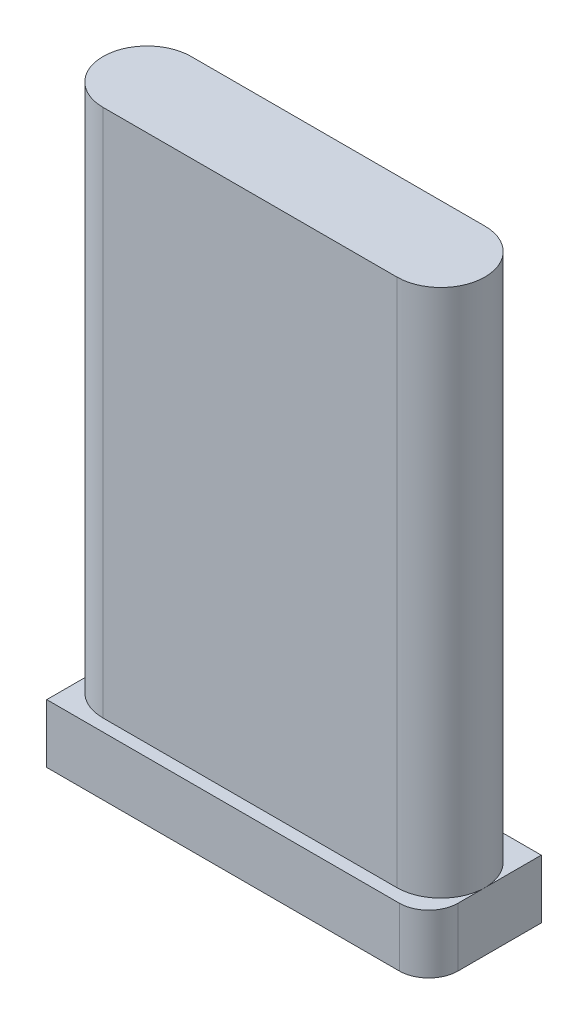
from build123d import *

# Parameters (mm, degrees)
EXTRUDE_1_DEPTH     = 18
SKETCH_2_W          = 13
SKETCH_2_H          = 3.83198423
EXTRUDE_2_DEPTH     = 2
SKETCH_5_W          = 0.107212475
SKETCH_5_H          = 0.128654971
CUT_EXTRUDE_1_DEPTH = 0.5
FILLET_3_R          = 1
FILLET_4_R          = 1


with BuildPart() as part:
    # 草图1 → 凸台-拉伸1 (new body)
    with BuildSketch(Plane(origin=(0, 0, 0), x_dir=(1, 0, 0), z_dir=(0, 1, 0))):
        with BuildLine():
            Line((-5, 1.5), (5, 1.5))
            ThreePointArc((5, 1.5), (6.5, 0), (5, -1.5))
            Line((5, -1.5), (-5, -1.5))
            ThreePointArc((-5, -1.5), (-6.5, 0), (-5, 1.5))
        make_face()
    extrude(amount=EXTRUDE_1_DEPTH)

    # 草图2 → 凸台-拉伸2 (add)
    with BuildSketch(Plane.XZ):
        Rectangle(SKETCH_2_W, SKETCH_2_H)
    extrude(amount=EXTRUDE_2_DEPTH)

    # 草图5 → 切除-拉伸1 (cut)
    # profile 1 of 12: a face of its own
    with BuildSketch(Plane.XZ.offset(2)):
        with BuildLine():
            Line((-1.02805632, -1.163211224), (-1.12119039, -1.163211224))
            Line((-1.12119039, -1.163211224), (-1.12119039, -1.075491926))
            add(Edge.make_bspline(
                [(-1.12119039, -1.075491926), (-1.125826492, -1.083779294), (-1.134718723, -1.099674798), (-1.150757558, -1.120561989), (-1.167526976, -1.138180102), (-1.185936765, -1.151956709), (-1.20581427, -1.162249349), (-1.227241919, -1.169685065), (-1.250464438, -1.174041531), (-1.266504279, -1.174613154), (-1.274753309, -1.17490713)],
                knots=[0, 0, 0, 0, 1.174709756, 2.253140365, 3.252247874, 4.178642246, 5.086553947, 6.014112808, 6.978690469, 8, 8, 8, 8], degree=3))
            add(Edge.make_bspline(
                [(-1.274753309, -1.17490713), (-1.282348599, -1.174653903), (-1.297423973, -1.17415129), (-1.319596673, -1.170239132), (-1.340851493, -1.163344952), (-1.361265544, -1.15406953), (-1.380707605, -1.141981113), (-1.399189397, -1.127265822), (-1.417064027, -1.110157631), (-1.433649445, -1.090110249), (-1.449135963, -1.067675428), (-1.462405679, -1.042287873), (-1.473265502, -1.014153308), (-1.482669924, -0.983579068), (-1.489733723, -0.950305537), (-1.494581026, -0.914464968), (-1.49766591, -0.875993165), (-1.498067465, -0.849449448), (-1.498275077, -0.835725844)],
                knots=[0, 0, 0, 0, 0.803415974, 1.594645798, 2.372561691, 3.162204217, 3.961432765, 4.788224023, 5.658044298, 6.574515724, 7.53646856, 8.53765953, 9.597323997, 10.723414068, 11.919076493, 13.191717926, 14.548064934, 16, 16, 16, 16], degree=3))
            add(Edge.make_bspline(
                [(-1.498275077, -0.835725844), (-1.498065146, -0.822002455), (-1.497658003, -0.795387177), (-1.494586362, -0.756769588), (-1.489703039, -0.720648869), (-1.482707016, -0.687072492), (-1.473227162, -0.656159154), (-1.462359071, -0.62761024), (-1.449144241, -0.601628437), (-1.433651006, -0.578547086), (-1.417073745, -0.55785133), (-1.399191229, -0.540104541), (-1.380780032, -0.524725378), (-1.36133026, -0.512172965), (-1.340856958, -0.502703322), (-1.319611564, -0.49559536), (-1.297445186, -0.491396255), (-1.282351386, -0.490930873), (-1.274753309, -0.490696604)],
                knots=[0, 0, 0, 0, 1.438076013, 2.789019155, 4.057007111, 5.256053152, 6.378633748, 7.442270566, 8.454050262, 9.425651909, 10.350896601, 11.228315056, 12.061456595, 12.86111499, 13.646397793, 14.419225205, 15.204252816, 16, 16, 16, 16], degree=3))
            add(Edge.make_bspline(
                [(-1.274753309, -0.490696604), (-1.26650375, -0.491056339), (-1.250439299, -0.491756856), (-1.22708129, -0.496442107), (-1.205701692, -0.505120977), (-1.185852301, -0.516720608), (-1.167709871, -0.531816394), (-1.150713211, -0.550010654), (-1.134846686, -0.571521728), (-1.125850888, -0.587619768), (-1.12119039, -0.595959762)],
                knots=[0, 0, 0, 0, 1.005885868, 1.95877182, 2.887154711, 3.806480809, 4.750914281, 5.753444165, 6.83611536, 8, 8, 8, 8], degree=3))
            Line((-1.12119039, -0.595959762), (-1.12119039, -0.163211224))
            Line((-1.12119039, -0.163211224), (-1.02805632, -0.163211224))
            Line((-1.02805632, -0.163211224), (-1.02805632, -1.163211224))
        make_face()
        with BuildLine():
            add(Edge.make_bspline(
                [(-1.12119039, -0.835725844), (-1.121335947, -0.826699624), (-1.121619185, -0.809135551), (-1.123211196, -0.783512226), (-1.1265738, -0.759384229), (-1.130864876, -0.736677245), (-1.136120674, -0.715302357), (-1.143167217, -0.69560597), (-1.151144059, -0.677220183), (-1.160426801, -0.660445279), (-1.170487508, -0.645358271), (-1.181168051, -0.632245886), (-1.192248891, -0.62102482), (-1.203931743, -0.611859738), (-1.216264529, -0.604774592), (-1.229121058, -0.599797428), (-1.242473496, -0.596616996), (-1.251560754, -0.59617955), (-1.256126495, -0.595959762)],
                knots=[0, 0, 0, 0, 1.432479259, 2.787453692, 4.070687906, 5.295251639, 6.453948626, 7.559073814, 8.610643949, 9.631047629, 10.597004077, 11.484497415, 12.310798766, 13.09454635, 13.833470659, 14.55895071, 15.275968737, 16, 16, 16, 16], degree=3))
            add(Edge.make_bspline(
                [(-1.256126495, -0.595959762), (-1.261772144, -0.596172072), (-1.27278681, -0.59658629), (-1.288746669, -0.599692453), (-1.303621794, -0.604685638), (-1.317487901, -0.611657993), (-1.330107527, -0.620904306), (-1.341664581, -0.63206941), (-1.352174562, -0.645227136), (-1.361353904, -0.660452495), (-1.369562169, -0.677266756), (-1.376422931, -0.695679559), (-1.382516293, -0.715399126), (-1.387539608, -0.736659879), (-1.391008826, -0.759423632), (-1.393993676, -0.783531169), (-1.395348331, -0.809142383), (-1.395664881, -0.826700389), (-1.3958276, -0.835725844)],
                knots=[0, 0, 0, 0, 0.872697501, 1.702633898, 2.504143522, 3.293111638, 4.092674618, 4.913928249, 5.771858229, 6.689130751, 7.657895829, 8.661550593, 9.724622335, 10.848574145, 12.036219453, 13.284062286, 14.603909012, 16, 16, 16, 16], degree=3))
            add(Edge.make_bspline(
                [(-1.3958276, -0.835725844), (-1.395667326, -0.844751477), (-1.39535681, -0.862237772), (-1.393976313, -0.887774606), (-1.391046355, -0.911672553), (-1.387539965, -0.934146028), (-1.382511208, -0.954971043), (-1.376472879, -0.974208886), (-1.369541554, -0.992019858), (-1.361436386, -1.008184376), (-1.352025127, -1.022604802), (-1.341742543, -1.035299968), (-1.330019037, -1.045801277), (-1.317420448, -1.054586873), (-1.303615731, -1.061382019), (-1.288704701, -1.066057431), (-1.27279915, -1.069304615), (-1.261774983, -1.069529002), (-1.256126495, -1.069643973)],
                knots=[0, 0, 0, 0, 1.417119592, 2.74553286, 4.012171311, 5.195335048, 6.314160584, 7.371600832, 8.35867376, 9.311580589, 10.204356249, 11.057626038, 11.868044535, 12.666567361, 13.462350821, 14.272372967, 15.114810271, 16, 16, 16, 16], degree=3))
            add(Edge.make_bspline(
                [(-1.256126495, -1.069643973), (-1.251557707, -1.069520207), (-1.242459279, -1.069273736), (-1.229167464, -1.065957062), (-1.216268284, -1.061297596), (-1.203996166, -1.054392961), (-1.192329784, -1.045687056), (-1.181081857, -1.035122697), (-1.170634382, -1.022463734), (-1.160341178, -1.008198469), (-1.151167114, -0.992065948), (-1.143113356, -0.97428896), (-1.136127223, -0.955068957), (-1.130864405, -0.934128524), (-1.126529552, -0.911714414), (-1.123231399, -0.887792905), (-1.12160961, -0.862244855), (-1.121333083, -0.844752316), (-1.12119039, -0.835725844)],
                knots=[0, 0, 0, 0, 0.73435204, 1.462411633, 2.194918564, 2.939518723, 3.721267318, 4.535989702, 5.419252214, 6.361808964, 7.367504887, 8.403426123, 9.503648099, 10.657658594, 11.878232492, 13.181227598, 14.545461582, 16, 16, 16, 16], degree=3))
        make_face(mode=Mode.SUBTRACT)
    # profile 2 of 12: a face of its own
    with BuildSketch(Plane.XZ.offset(2)):
        with BuildLine():
            add(Edge.make_bspline(
                [(-0.477525672, -0.835725844), (-0.477733284, -0.849449448), (-0.478134839, -0.875993165), (-0.481219723, -0.914464968), (-0.486067026, -0.950305537), (-0.493130825, -0.983579068), (-0.502535247, -1.014153308), (-0.51339507, -1.042287873), (-0.526664786, -1.067675428), (-0.542151304, -1.090110249), (-0.558736722, -1.110157631), (-0.576611352, -1.127265822), (-0.595093144, -1.141981113), (-0.614535205, -1.15406953), (-0.634949256, -1.163344952), (-0.656204076, -1.170239132), (-0.678376776, -1.17415129), (-0.69345215, -1.174653903), (-0.70104744, -1.17490713)],
                knots=[0, 0, 0, 0, 1.451935066, 2.808282074, 4.080923507, 5.276585932, 6.402676003, 7.46234047, 8.46353144, 9.425484276, 10.341955702, 11.211775977, 12.038567235, 12.837795783, 13.627438309, 14.405354202, 15.196584026, 16, 16, 16, 16], degree=3))
            add(Edge.make_bspline(
                [(-0.70104744, -1.17490713), (-0.709295425, -1.17460724), (-0.725404211, -1.174021537), (-0.748709926, -1.16971854), (-0.77020262, -1.162246753), (-0.790080697, -1.151957412), (-0.808490329, -1.138179896), (-0.825259792, -1.120562051), (-0.841298613, -1.099674781), (-0.850190846, -1.083779288), (-0.85482695, -1.075491926)],
                knots=[0, 0, 0, 0, 1.020188805, 1.992486735, 2.919027747, 3.825943157, 4.751320956, 5.749332102, 6.826579303, 8, 8, 8, 8], degree=3))
            Line((-0.85482695, -1.075491926), (-0.85482695, -1.163211224))
            Line((-0.85482695, -1.163211224), (-0.94796102, -1.163211224))
            Line((-0.94796102, -1.163211224), (-0.94796102, -0.163211224))
            Line((-0.94796102, -0.163211224), (-0.85482695, -0.163211224))
            Line((-0.85482695, -0.163211224), (-0.85482695, -0.595959762))
            add(Edge.make_bspline(
                [(-0.85482695, -0.595959762), (-0.85016645, -0.587619775), (-0.84117065, -0.571521747), (-0.825304141, -0.550010587), (-0.808307427, -0.531816619), (-0.790165184, -0.516719827), (-0.770315121, -0.50512382), (-0.748872264, -0.496404491), (-0.725428459, -0.491778867), (-0.709295752, -0.491062743), (-0.70104744, -0.490696604)],
                knots=[0, 0, 0, 0, 1.162631916, 2.2441378, 3.245588632, 4.189005582, 5.107342182, 6.034725827, 6.995196796, 8, 8, 8, 8], degree=3))
            add(Edge.make_bspline(
                [(-0.70104744, -0.490696604), (-0.693449363, -0.490930873), (-0.678355563, -0.491396255), (-0.656189185, -0.49559536), (-0.634943791, -0.502703322), (-0.614470489, -0.512172965), (-0.595020717, -0.524725378), (-0.57660952, -0.540104541), (-0.558727004, -0.55785133), (-0.542149743, -0.578547086), (-0.526656508, -0.601628437), (-0.513441678, -0.62761024), (-0.502573587, -0.656159154), (-0.493093733, -0.687072492), (-0.48609771, -0.720648869), (-0.481214387, -0.756769588), (-0.478142746, -0.795387177), (-0.477735603, -0.822002455), (-0.477525672, -0.835725844)],
                knots=[0, 0, 0, 0, 0.795747184, 1.580774795, 2.353602207, 3.13888501, 3.938543405, 4.771684944, 5.649103399, 6.574348091, 7.545949738, 8.557729434, 9.621366252, 10.743946848, 11.942992889, 13.210980845, 14.561923987, 16, 16, 16, 16], degree=3))
        make_face()
        with BuildLine():
            add(Edge.make_bspline(
                [(-0.579973149, -0.835725844), (-0.580135915, -0.826700407), (-0.580452559, -0.809142437), (-0.581806559, -0.783530972), (-0.584793701, -0.759424316), (-0.588254989, -0.736657512), (-0.593305594, -0.715407256), (-0.599312852, -0.69562671), (-0.606509285, -0.677314961), (-0.614650262, -0.660449559), (-0.623835317, -0.645216842), (-0.634358343, -0.632149845), (-0.645696627, -0.620833633), (-0.658322942, -0.611668456), (-0.672176222, -0.604682806), (-0.687054841, -0.599693243), (-0.703013734, -0.596586078), (-0.714028536, -0.596172), (-0.719674254, -0.595959762)],
                knots=[0, 0, 0, 0, 1.396438336, 2.716613439, 3.964766736, 5.152707529, 6.276938979, 7.340275213, 8.34820958, 9.317215687, 10.234716427, 11.09285986, 11.906307124, 12.706069036, 13.495233447, 14.296942486, 15.127085372, 16, 16, 16, 16], degree=3))
            add(Edge.make_bspline(
                [(-0.719674254, -0.595959762), (-0.724239943, -0.596179602), (-0.733327097, -0.596617154), (-0.74668031, -0.599796802), (-0.759533849, -0.604776991), (-0.771878271, -0.611850366), (-0.783554435, -0.621094929), (-0.794857981, -0.632164428), (-0.805517431, -0.64537082), (-0.815594192, -0.660441582), (-0.824872247, -0.677221229), (-0.832850419, -0.69560567), (-0.839896581, -0.715302443), (-0.845152488, -0.73667722), (-0.849443533, -0.759384236), (-0.852806146, -0.783512224), (-0.854398154, -0.809135551), (-0.854681393, -0.826699624), (-0.85482695, -0.835725844)],
                knots=[0, 0, 0, 0, 0.723663085, 1.4403165, 2.165427637, 2.903976194, 3.687325234, 4.52134258, 5.408384618, 6.373849866, 7.393734659, 8.444770059, 9.549333278, 10.707441056, 11.931382085, 13.213963759, 14.568249173, 16, 16, 16, 16], degree=3))
            add(Edge.make_bspline(
                [(-0.85482695, -0.835725844), (-0.854684257, -0.844752316), (-0.85440773, -0.862244854), (-0.852785942, -0.887792908), (-0.849487781, -0.911714406), (-0.845152958, -0.934128549), (-0.839890037, -0.955068871), (-0.832904262, -0.974289259), (-0.824849268, -0.992064916), (-0.815679537, -1.008202104), (-0.805371536, -1.022451434), (-0.794940417, -1.035205066), (-0.783477377, -1.045616712), (-0.771813522, -1.054402572), (-0.759530162, -1.06129512), (-0.74663389, -1.065957713), (-0.733341317, -1.069273572), (-0.724242991, -1.069520152), (-0.719674254, -1.069643973)],
                knots=[0, 0, 0, 0, 1.453765221, 2.817274013, 4.119576478, 5.33950155, 6.492898601, 7.592535726, 8.627906292, 9.633067612, 10.575123322, 11.457916314, 12.280710816, 13.062043853, 13.806248201, 14.538365749, 15.266038324, 16, 16, 16, 16], degree=3))
            add(Edge.make_bspline(
                [(-0.719674254, -1.069643973), (-0.714025698, -1.069529077), (-0.703001398, -1.069304836), (-0.687096792, -1.066056612), (-0.672182365, -1.061384942), (-0.658390039, -1.054576142), (-0.645788956, -1.045872144), (-0.634276639, -1.035218761), (-0.623985702, -1.02261475), (-0.614567885, -1.008187471), (-0.60652864, -0.991970332), (-0.599263151, -0.97426359), (-0.593310824, -0.954962551), (-0.588254586, -0.934148501), (-0.584756223, -0.911671823), (-0.581823908, -0.887774816), (-0.580444084, -0.862237714), (-0.580133473, -0.844751457), (-0.579973149, -0.835725844)],
                knots=[0, 0, 0, 0, 0.88541906, 1.728074619, 2.538306622, 3.33429625, 4.133025954, 4.935287746, 5.788778596, 6.681785553, 7.634939257, 8.626489366, 9.684203571, 10.803318967, 11.986789233, 13.253755839, 14.582513267, 16, 16, 16, 16], degree=3))
        make_face(mode=Mode.SUBTRACT)
    # profile 3 of 12: a face of its own
    with BuildSketch(Plane.XZ.offset(2)):
        with Locations((-0.320648913, -1.098883739)):
            Rectangle(SKETCH_5_W, SKETCH_5_H)
    # profile 4 of 12: a face of its own
    with BuildSketch(Plane.XZ.offset(2)):
        with BuildLine():
            add(Edge.make_bspline(
                [(1.127066054, -0.829877891), (1.126826608, -0.84446482), (1.126363847, -0.872655955), (1.123723789, -0.913394935), (1.11863485, -0.950972816), (1.11214871, -0.985572575), (1.103295597, -1.017027882), (1.092485898, -1.045412249), (1.079737239, -1.070750024), (1.064905316, -1.093023536), (1.048411759, -1.112386131), (1.030432258, -1.128976775), (1.01130693, -1.143286816), (0.990485427, -1.154765675), (0.968442461, -1.163965567), (0.944890006, -1.170154503), (0.920074947, -1.174228207), (0.902983717, -1.174677193), (0.89423088, -1.17490713)],
                knots=[0, 0, 0, 0, 1.486786668, 2.873408288, 4.157555986, 5.349518925, 6.458271403, 7.483132839, 8.440729295, 9.342746622, 10.203893069, 11.026551008, 11.831546077, 12.631988447, 13.443647967, 14.25936631, 15.108578851, 16, 16, 16, 16], degree=3))
            add(Edge.make_bspline(
                [(0.89423088, -1.17490713), (0.886274156, -1.17464974), (0.870563591, -1.174141522), (0.847544002, -1.170341681), (0.825459441, -1.164367089), (0.804532796, -1.155503976), (0.784453447, -1.144484057), (0.765565991, -1.130692858), (0.747754025, -1.114475372), (0.730705142, -1.096080247), (0.71521841, -1.074762925), (0.701994008, -1.050266575), (0.691093608, -1.022705165), (0.681715486, -0.992327403), (0.674667561, -0.958827567), (0.669848877, -0.922404665), (0.666760219, -0.882995419), (0.666365602, -0.855730551), (0.666160704, -0.841573797)],
                knots=[0, 0, 0, 0, 0.839199475, 1.657000945, 2.45541367, 3.247660954, 4.048975689, 4.867238262, 5.708647614, 6.58746802, 7.509343168, 8.480869226, 9.516352645, 10.632010286, 11.831777626, 13.123499464, 14.506432833, 16, 16, 16, 16], degree=3))
            Line((0.666160704, -0.841573797), (0.666160704, -0.777246312))
            Line((0.666160704, -0.777246312), (0.773156589, -0.777246312))
            Line((0.773156589, -0.777246312), (0.773156589, -0.859117657))
            add(Edge.make_bspline(
                [(0.773156589, -0.859117657), (0.77331619, -0.867565741), (0.773623376, -0.883825851), (0.774984958, -0.907348173), (0.777886233, -0.92887254), (0.781419574, -0.948614217), (0.786377261, -0.966377213), (0.792473384, -0.982214275), (0.799266076, -0.996355481), (0.810119286, -1.011743811), (0.825074053, -1.027527333), (0.845112608, -1.041633844), (0.866905248, -1.050446286), (0.882097304, -1.051549363), (0.889682472, -1.052100113)],
                knots=[0, 0, 0, 0, 1.208963819, 2.326904589, 3.368559454, 4.314665505, 5.194383674, 6.002012704, 6.741140787, 7.431682472, 8.688336075, 9.831616499, 10.917358293, 12, 12, 12, 12], degree=3))
            add(Edge.make_bspline(
                [(0.889682472, -1.052100113), (0.894967555, -1.052036039), (0.90523552, -1.051911554), (0.920031648, -1.049199518), (0.933998416, -1.046095672), (0.946668087, -1.040606769), (0.958603358, -1.03417946), (0.969267677, -1.025922365), (0.979094825, -1.016399967), (0.987776009, -1.005263938), (0.99554343, -0.992120491), (1.002112453, -0.976740156), (1.007789237, -0.958979475), (1.012128608, -0.938860458), (1.015875498, -0.916466583), (1.018382366, -0.891654509), (1.019892695, -0.864479637), (1.020009552, -0.845546803), (1.020070169, -0.835725844)],
                knots=[0, 0, 0, 0, 0.879390031, 1.708496612, 2.50252622, 3.258036476, 4.00156295, 4.757456617, 5.497956843, 6.278089744, 7.103782007, 8.03626356, 9.06019656, 10.207753371, 11.464262521, 12.843979269, 14.362889033, 16, 16, 16, 16], degree=3))
            Line((1.020070169, -0.835725844), (1.020070169, -0.163211224))
            Line((1.020070169, -0.163211224), (1.127066054, -0.163211224))
            Line((1.127066054, -0.163211224), (1.127066054, -0.829877891))
        make_face()
    # profile 5 of 12: a face of its own
    with BuildSketch(Plane.XZ.offset(2)):
        with BuildLine():
            Line((1.677596702, -1.163211224), (1.565835818, -1.163211224))
            add(Edge.make_bspline(
                [(1.565835818, -1.163211224), (1.562864602, -1.158701035), (1.556371228, -1.148844351), (1.551031576, -1.129936615), (1.547628996, -1.107105221), (1.54735642, -1.090383468), (1.547209004, -1.081339879)],
                knots=[0, 0, 0, 0, 0.755692807, 1.651510663, 2.729871745, 4, 4, 4, 4], degree=3))
            add(Edge.make_bspline(
                [(1.547209004, -1.081339879), (1.541689724, -1.088786713), (1.530813677, -1.103461111), (1.511584559, -1.122463837), (1.490794361, -1.138802583), (1.468294906, -1.151939512), (1.444654913, -1.162038092), (1.420443093, -1.169562533), (1.395540579, -1.173987663), (1.37871838, -1.174599356), (1.370254271, -1.17490713)],
                knots=[0, 0, 0, 0, 1.066987184, 2.1025574, 3.104587707, 4.107861057, 5.095589085, 6.06159213, 7.024687844, 8, 8, 8, 8], degree=3))
            add(Edge.make_bspline(
                [(1.370254271, -1.17490713), (1.364178032, -1.174834982), (1.352192548, -1.174692669), (1.3346531, -1.171986302), (1.317648433, -1.168840281), (1.301583007, -1.163387014), (1.285999619, -1.157026066), (1.271446461, -1.148656151), (1.257292679, -1.139332956), (1.244234313, -1.128348487), (1.232238955, -1.116006543), (1.221795729, -1.102249317), (1.212887114, -1.087300429), (1.205676483, -1.070999881), (1.200064891, -1.053505842), (1.196215577, -1.034619944), (1.193817203, -1.014547187), (1.193474733, -1.000702823), (1.193299539, -0.993620581)],
                knots=[0, 0, 0, 0, 1.019473972, 2.010929629, 2.976679566, 3.920239561, 4.855106573, 5.799913014, 6.735094691, 7.699472715, 8.660182727, 9.620816173, 10.594303763, 11.577041028, 12.608850109, 13.674534758, 14.810381812, 16, 16, 16, 16], degree=3))
            add(Edge.make_bspline(
                [(1.193299539, -0.993620581), (1.193398344, -0.986466903), (1.193590459, -0.972557467), (1.195837398, -0.952206745), (1.199446543, -0.932917021), (1.204666861, -0.914745067), (1.211144009, -0.897653597), (1.219264761, -0.8817213), (1.228726362, -0.866819263), (1.239679893, -0.853019899), (1.252117228, -0.840329745), (1.266272575, -0.828871173), (1.282053725, -0.818452337), (1.299248335, -0.808834973), (1.318342526, -0.800998176), (1.338752355, -0.793742576), (1.360843605, -0.787712119), (1.376225745, -0.78465991), (1.384116086, -0.783094265)],
                knots=[0, 0, 0, 0, 1.090965144, 2.121245881, 3.119285887, 4.081552798, 5.002062747, 5.9035279, 6.804925756, 7.690846656, 8.586573589, 9.510372729, 10.463518421, 11.469187795, 12.510537376, 13.607878435, 14.772949993, 16, 16, 16, 16], degree=3))
            add(Edge.make_bspline(
                [(1.384116086, -0.783094265), (1.394673476, -0.781079466), (1.415140119, -0.777173559), (1.444676917, -0.770188679), (1.472250309, -0.762655497), (1.497271271, -0.754580067), (1.518735689, -0.745692544), (1.534671903, -0.73479071), (1.545336284, -0.721782711), (1.546601123, -0.711846305), (1.547209004, -0.707070873)],
                knots=[0, 0, 0, 0, 1.358372605, 2.633352517, 3.835515171, 4.969630947, 5.958279621, 6.756029877, 7.402148543, 8, 8, 8, 8], degree=3))
            add(Edge.make_bspline(
                [(1.547209004, -0.707070873), (1.546948112, -0.701204532), (1.546420695, -0.689345167), (1.542386572, -0.671566195), (1.535386426, -0.654048582), (1.528222062, -0.63940039), (1.520359694, -0.628381616), (1.512622169, -0.621246149), (1.503551414, -0.615022698), (1.492869164, -0.610057617), (1.480560245, -0.60654409), (1.466903608, -0.603609403), (1.451645342, -0.60227274), (1.441008572, -0.601967357), (1.43544812, -0.601807715)],
                knots=[0, 0, 0, 0, 1.201047136, 2.428030805, 3.710519291, 5.059727363, 5.757709653, 6.469035333, 7.20320303, 8.003627984, 8.869028397, 9.820250763, 10.860519476, 12, 12, 12, 12], degree=3))
            add(Edge.make_bspline(
                [(1.43544812, -0.601807715), (1.426765103, -0.602143149), (1.41047793, -0.602772338), (1.387663325, -0.607290661), (1.368623608, -0.615761785), (1.353315334, -0.627665134), (1.341430544, -0.642587532), (1.331782825, -0.659840555), (1.323797607, -0.679534438), (1.320591383, -0.693797588), (1.318922238, -0.70122292)],
                knots=[0, 0, 0, 0, 1.226234213, 2.300109206, 3.262914802, 4.141960168, 5.011433283, 5.938427283, 6.926754434, 8, 8, 8, 8], degree=3))
            Line((1.318922238, -0.70122292), (1.216474761, -0.70122292))
            add(Edge.make_bspline(
                [(1.216474761, -0.70122292), (1.217341963, -0.693618418), (1.219047405, -0.678663387), (1.224005613, -0.657073758), (1.229918235, -0.636476556), (1.237827375, -0.617283042), (1.246882484, -0.599042385), (1.257781211, -0.582242646), (1.269983227, -0.566406925), (1.283810402, -0.552003701), (1.298934181, -0.538957568), (1.315308453, -0.527766753), (1.332456182, -0.517757577), (1.351010016, -0.510070813), (1.370583246, -0.503962471), (1.391257048, -0.499676244), (1.412997238, -0.497013657), (1.427859564, -0.496703116), (1.43544812, -0.496544557)],
                knots=[0, 0, 0, 0, 1.103598428, 2.170338963, 3.192178795, 4.192386246, 5.161508673, 6.12675942, 7.077051162, 8.042358131, 9.002874465, 9.953680048, 10.90088289, 11.862585012, 12.844558058, 13.855988384, 14.905288963, 16, 16, 16, 16], degree=3))
            add(Edge.make_bspline(
                [(1.43544812, -0.496544557), (1.44375967, -0.496679617), (1.459856735, -0.496941188), (1.483118108, -0.499836923), (1.504784775, -0.504398453), (1.524968114, -0.510552886), (1.543548309, -0.518799483), (1.560345931, -0.529114787), (1.575626836, -0.541089873), (1.589369691, -0.554838515), (1.601424556, -0.570225705), (1.612046036, -0.587070831), (1.620488095, -0.605623153), (1.628033189, -0.625367305), (1.633578251, -0.646655261), (1.637430407, -0.669413983), (1.639826085, -0.693591373), (1.640168012, -0.710241909), (1.640343074, -0.71876678)],
                knots=[0, 0, 0, 0, 1.155966974, 2.238773138, 3.255437077, 4.234066209, 5.169406268, 6.075647623, 6.969950584, 7.864986743, 8.773397007, 9.684912576, 10.628630906, 11.604523476, 12.623071688, 13.683368923, 14.813913343, 16, 16, 16, 16], degree=3))
            Line((1.640343074, -0.71876678), (1.640343074, -1.040404206))
            add(Edge.make_bspline(
                [(1.640343074, -1.040404206), (1.640777927, -1.051634765), (1.641620128, -1.073385518), (1.648866037, -1.104976687), (1.660914993, -1.134931845), (1.671925537, -1.15359728), (1.677596702, -1.163211224)],
                knots=[0, 0, 0, 0, 1.034579128, 2.003718185, 2.971781755, 4, 4, 4, 4], degree=3))
        make_face()
        with BuildLine():
            Line((1.547209004, -0.946836955), (1.547209004, -0.829877891))
            add(Edge.make_bspline(
                [(1.547209004, -0.829877891), (1.538138004, -0.833624483), (1.520412295, -0.840945727), (1.497497452, -0.84931471), (1.477242331, -0.855576044), (1.457785846, -0.860114371), (1.434156594, -0.865625785), (1.416834689, -0.86899789), (1.407507899, -0.870813563)],
                knots=[0, 0, 0, 0, 1.210374826, 2.365202409, 3.007430543, 3.82377418, 4.828235109, 6, 6, 6, 6], degree=3))
            add(Edge.make_bspline(
                [(1.407507899, -0.870813563), (1.401939658, -0.87184959), (1.391258354, -0.873836953), (1.376029546, -0.877442838), (1.36238656, -0.881814894), (1.350152662, -0.886495805), (1.33944801, -0.891892317), (1.330321422, -0.897972554), (1.322617618, -0.904460566), (1.314459259, -0.913804166), (1.307066583, -0.92697735), (1.300364289, -0.94393767), (1.296459127, -0.96247307), (1.295988188, -0.975336965), (1.295747016, -0.981924674)],
                knots=[0, 0, 0, 0, 1.156381088, 2.218233285, 3.192579397, 4.079483205, 4.890363406, 5.634447372, 6.313966524, 6.940755641, 8.156763269, 9.374913329, 10.655670945, 12, 12, 12, 12], degree=3))
            add(Edge.make_bspline(
                [(1.295747016, -0.981924674), (1.295992994, -0.987577031), (1.296478434, -0.998731987), (1.300437871, -1.014893626), (1.307169523, -1.029895463), (1.316014603, -1.043834246), (1.328031105, -1.05544507), (1.342844651, -1.064017326), (1.360454149, -1.068664138), (1.372971583, -1.069305831), (1.379567678, -1.069643973)],
                knots=[0, 0, 0, 0, 0.991579906, 1.956888123, 2.898948725, 3.869237069, 4.837370503, 5.80267872, 6.842115669, 8, 8, 8, 8], degree=3))
            add(Edge.make_bspline(
                [(1.379567678, -1.069643973), (1.386752838, -1.06932987), (1.401552784, -1.068682884), (1.423919543, -1.062434598), (1.44717693, -1.053304584), (1.471064246, -1.040702898), (1.494296519, -1.023988199), (1.515031034, -1.002393851), (1.532992668, -0.97641967), (1.542350219, -0.956947581), (1.547209004, -0.946836955)],
                knots=[0, 0, 0, 0, 0.784364532, 1.615629125, 2.523387198, 3.516104134, 4.561781045, 5.639645558, 6.774417002, 8, 8, 8, 8], degree=3))
        make_face(mode=Mode.SUBTRACT)
    # profile 6 of 12: a face of its own
    with BuildSketch(Plane.XZ.offset(2)):
        with BuildLine():
            Line((2.246537572, -1.163211224), (2.153403502, -1.163211224))
            Line((2.153403502, -1.163211224), (2.153403502, -0.689527013))
            add(Edge.make_bspline(
                [(2.153403502, -0.689527013), (2.153274399, -0.683890692), (2.153027123, -0.673095222), (2.151288391, -0.657662539), (2.148547351, -0.643698947), (2.14462462, -0.631300788), (2.13891547, -0.620737076), (2.130454998, -0.612784252), (2.119252816, -0.608449166), (2.111131627, -0.607930161), (2.106836468, -0.607655668)],
                knots=[0, 0, 0, 0, 1.270035363, 2.432549112, 3.495124476, 4.472707893, 5.354621656, 6.172202893, 7.033309218, 8, 8, 8, 8], degree=3))
            add(Edge.make_bspline(
                [(2.106836468, -0.607655668), (2.101391613, -0.608239459), (2.090110838, -0.60944897), (2.074213711, -0.618667827), (2.05935793, -0.632895453), (2.045376381, -0.651995012), (2.033450945, -0.675442758), (2.024432118, -0.702553736), (2.019388975, -0.733018674), (2.018782886, -0.754413636), (2.018467397, -0.765550405)],
                knots=[0, 0, 0, 0, 0.662251153, 1.372067081, 2.189144401, 3.165789731, 4.245935429, 5.388746942, 6.640758346, 8, 8, 8, 8], degree=3))
            Line((2.018467397, -0.765550405), (2.018467397, -1.163211224))
            Line((2.018467397, -1.163211224), (1.925333327, -1.163211224))
            Line((1.925333327, -1.163211224), (1.925333327, -0.689527013))
            add(Edge.make_bspline(
                [(1.925333327, -0.689527013), (1.925204224, -0.683890692), (1.924956947, -0.673095222), (1.923218215, -0.657662539), (1.920477176, -0.643698947), (1.916554444, -0.631300788), (1.910845294, -0.620737076), (1.902384822, -0.612784252), (1.891182641, -0.608449166), (1.883061451, -0.607930161), (1.878766292, -0.607655668)],
                knots=[0, 0, 0, 0, 1.270035363, 2.432549112, 3.495124476, 4.472707893, 5.354621656, 6.172202893, 7.033309218, 8, 8, 8, 8], degree=3))
            add(Edge.make_bspline(
                [(1.878766292, -0.607655668), (1.873319144, -0.608236968), (1.862033617, -0.609441316), (1.846129037, -0.618730575), (1.831060823, -0.632806436), (1.817103029, -0.652009706), (1.805160204, -0.675438405), (1.79614655, -0.702555048), (1.791101867, -0.733018299), (1.790496002, -0.754413507), (1.79018063, -0.765550405)],
                knots=[0, 0, 0, 0, 0.661714531, 1.370955294, 2.19385294, 3.169706894, 4.24897735, 5.390862842, 6.64185974, 8, 8, 8, 8], degree=3))
            Line((1.79018063, -0.765550405), (1.79018063, -1.163211224))
            Line((1.79018063, -1.163211224), (1.697046561, -1.163211224))
            Line((1.697046561, -1.163211224), (1.697046561, -0.508240464))
            Line((1.697046561, -0.508240464), (1.79018063, -0.508240464))
            Line((1.79018063, -0.508240464), (1.79018063, -0.595959762))
            add(Edge.make_bspline(
                [(1.79018063, -0.595959762), (1.794148807, -0.588508083), (1.801828504, -0.574086689), (1.815435232, -0.554494301), (1.829824643, -0.537252708), (1.845515348, -0.522764196), (1.862185482, -0.511334774), (1.879379056, -0.502502206), (1.897567788, -0.497659616), (1.909857765, -0.496916935), (1.91601992, -0.496544557)],
                knots=[0, 0, 0, 0, 1.199577009, 2.321567007, 3.385009352, 4.387749204, 5.347415204, 6.251899243, 7.123507784, 8, 8, 8, 8], degree=3))
            add(Edge.make_bspline(
                [(1.91601992, -0.496544557), (1.92203994, -0.496900561), (1.933772102, -0.497594361), (1.950757339, -0.502382519), (1.965856051, -0.511156563), (1.979399996, -0.522783724), (1.991229134, -0.537290058), (2.000831531, -0.554587463), (2.008829931, -0.574268437), (2.012034246, -0.588533456), (2.013702398, -0.595959762)],
                knots=[0, 0, 0, 0, 0.95063442, 1.852651139, 2.75625148, 3.68615134, 4.658348516, 5.694862393, 6.799955639, 8, 8, 8, 8], degree=3))
            add(Edge.make_bspline(
                [(2.013702398, -0.595959762), (2.017605187, -0.588512818), (2.025135904, -0.574143394), (2.038327079, -0.554649244), (2.051791642, -0.537271887), (2.066625434, -0.522886276), (2.082284212, -0.511238543), (2.098833618, -0.50248428), (2.11660472, -0.497641381), (2.128685432, -0.496912213), (2.134776689, -0.496544557)],
                knots=[0, 0, 0, 0, 1.220823653, 2.355668614, 3.415792144, 4.410010486, 5.348001136, 6.244223498, 7.114713993, 8, 8, 8, 8], degree=3))
            add(Edge.make_bspline(
                [(2.134776689, -0.496544557), (2.143565378, -0.496949957), (2.160315574, -0.4977226), (2.183738168, -0.5049765), (2.203536786, -0.51733037), (2.219651541, -0.534443032), (2.231682306, -0.556057076), (2.240635399, -0.581358356), (2.245673042, -0.61078054), (2.246238276, -0.631677988), (2.246537572, -0.642743388)],
                knots=[0, 0, 0, 0, 1.007374807, 1.919936574, 2.780348009, 3.660077411, 4.588731163, 5.601007404, 6.729710277, 8, 8, 8, 8], degree=3))
            Line((2.246537572, -0.642743388), (2.246537572, -1.163211224))
        make_face()
    # profile 7 of 12: a face of its own
    with BuildSketch(Plane.XZ.offset(2)):
        with BuildLine():
            add(Edge.make_bspline(
                [(2.745736186, -0.940989002), (2.744793198, -0.949600691), (2.742951283, -0.966421678), (2.73786974, -0.990899059), (2.731116637, -1.014031812), (2.723057647, -1.036173934), (2.712464266, -1.056670849), (2.700588035, -1.076113324), (2.686861258, -1.094169571), (2.671485558, -1.11076875), (2.655002872, -1.125823125), (2.637528871, -1.138966009), (2.619288856, -1.150003042), (2.600414828, -1.159215819), (2.580704398, -1.166175136), (2.560311547, -1.171120795), (2.53920451, -1.174256399), (2.524896538, -1.174688678), (2.517666011, -1.17490713)],
                knots=[0, 0, 0, 0, 1.154010528, 2.254098392, 3.325927714, 4.364195763, 5.388279647, 6.394904074, 7.397473974, 8.40520135, 9.406431502, 10.368574765, 11.314073297, 12.243575398, 13.162611097, 14.093705324, 15.036654809, 16, 16, 16, 16], degree=3))
            add(Edge.make_bspline(
                [(2.517666011, -1.17490713), (2.508555976, -1.17458222), (2.490603852, -1.173941956), (2.464311619, -1.169890372), (2.439326843, -1.162616513), (2.415631068, -1.152531415), (2.392872679, -1.140000128), (2.371599635, -1.124210828), (2.351591101, -1.1056665), (2.332963971, -1.084431744), (2.316201987, -1.060657486), (2.30131562, -1.034766155), (2.289036249, -1.006604979), (2.278829885, -0.976476437), (2.271093223, -0.944197215), (2.265538603, -0.909882259), (2.26196418, -0.873488157), (2.261616858, -0.848513333), (2.261439023, -0.835725844)],
                knots=[0, 0, 0, 0, 0.917804962, 1.808615327, 2.671770955, 3.532225954, 4.39828758, 5.282721523, 6.193700412, 7.141977247, 8.122720642, 9.119539581, 10.145257806, 11.212425565, 12.320208507, 13.484789482, 14.712174092, 16, 16, 16, 16], degree=3))
            add(Edge.make_bspline(
                [(2.261439023, -0.835725844), (2.261616851, -0.82293835), (2.26196416, -0.797963517), (2.265538676, -0.761569481), (2.271092969, -0.727254294), (2.278830772, -0.694975876), (2.28903312, -0.664844504), (2.301326673, -0.636693326), (2.316132983, -0.610817321), (2.333036725, -0.587215499), (2.351585097, -0.566000481), (2.371592037, -0.547441579), (2.392935928, -0.531709291), (2.415565687, -0.518875845), (2.439335598, -0.508850761), (2.4643092, -0.501557009), (2.490604487, -0.497510861), (2.50855619, -0.496869848), (2.517666011, -0.496544557)],
                knots=[0, 0, 0, 0, 1.288015736, 2.515581265, 3.680333902, 4.788280134, 5.855605195, 6.881474613, 7.878440485, 8.853403863, 9.801820476, 10.712933644, 11.597497955, 12.467253389, 13.327835221, 14.19111808, 15.082059752, 16, 16, 16, 16], degree=3))
            add(Edge.make_bspline(
                [(2.517666011, -0.496544557), (2.525623337, -0.496797071), (2.54126378, -0.497293398), (2.564205433, -0.501137463), (2.586150751, -0.507067302), (2.606965059, -0.5158472), (2.626452533, -0.527263231), (2.645104698, -0.540743428), (2.662475562, -0.55695349), (2.678735803, -0.57561631), (2.693774711, -0.597059475), (2.706370214, -0.621928264), (2.717182692, -0.649800465), (2.726056535, -0.680832031), (2.732826523, -0.715035487), (2.737825051, -0.752428617), (2.740496874, -0.793018521), (2.740951789, -0.821138479), (2.741187778, -0.835725844)],
                knots=[0, 0, 0, 0, 0.833872556, 1.639009926, 2.432354631, 3.212591317, 3.999372899, 4.795745098, 5.620636908, 6.484378965, 7.387266849, 8.358896966, 9.399077909, 10.517840463, 11.738089086, 13.051615798, 14.470511314, 16, 16, 16, 16], degree=3))
            Line((2.741187778, -0.835725844), (2.3638865, -0.835725844))
            add(Edge.make_bspline(
                [(2.3638865, -0.835725844), (2.363980437, -0.84605442), (2.364161313, -0.865942283), (2.366391218, -0.894573028), (2.369794894, -0.92082991), (2.374418319, -0.944774917), (2.380758963, -0.966344023), (2.388201256, -0.985634513), (2.397063983, -1.002619693), (2.407640614, -1.017018733), (2.419170776, -1.029399833), (2.431394104, -1.039997354), (2.443985215, -1.049349302), (2.457548141, -1.056636852), (2.47165279, -1.062599024), (2.48643419, -1.066678569), (2.501845447, -1.069125743), (2.51231428, -1.069468668), (2.517666011, -1.069643973)],
                knots=[0, 0, 0, 0, 1.569832021, 3.022740366, 4.362327616, 5.593534261, 6.725760522, 7.775392841, 8.732838038, 9.62853007, 10.482782515, 11.299475562, 12.085426803, 12.861506994, 13.634008967, 14.408924164, 15.186632415, 16, 16, 16, 16], degree=3))
            add(Edge.make_bspline(
                [(2.517666011, -1.069643973), (2.525868093, -1.069323476), (2.541723477, -1.068703927), (2.564236713, -1.062387071), (2.58446726, -1.052336157), (2.602091472, -1.037827033), (2.61719773, -1.019416571), (2.629086719, -0.996752812), (2.638249628, -0.970322274), (2.641553075, -0.951092397), (2.643288709, -0.940989002)],
                knots=[0, 0, 0, 0, 0.987181597, 1.90831327, 2.796285755, 3.693941793, 4.640612862, 5.649789815, 6.765197427, 8, 8, 8, 8], degree=3))
            Line((2.643288709, -0.940989002), (2.745736186, -0.940989002))
        make_face()
        with BuildLine():
            add(Edge.make_bspline(
                [(2.633975302, -0.742158592), (2.633191676, -0.735576235), (2.631678017, -0.722861701), (2.628160248, -0.704729949), (2.624088932, -0.688062758), (2.619170978, -0.672994948), (2.613496232, -0.659466411), (2.607353239, -0.647419263), (2.600033709, -0.637152143), (2.589831907, -0.625414957), (2.575064076, -0.613551354), (2.554995883, -0.603156442), (2.5323989, -0.596918804), (2.516550878, -0.596286735), (2.508352604, -0.595959762)],
                knots=[0, 0, 0, 0, 1.106603129, 2.137523284, 3.081986396, 3.970301118, 4.780844299, 5.530458601, 6.222819072, 6.880622839, 8.123337461, 9.358131952, 10.633346233, 12, 12, 12, 12], degree=3))
            add(Edge.make_bspline(
                [(2.508352604, -0.595959762), (2.5007299, -0.596304356), (2.485665438, -0.596985363), (2.463740076, -0.603390114), (2.443185462, -0.613824114), (2.427048923, -0.625463439), (2.415157922, -0.637087748), (2.406560716, -0.647396321), (2.398844543, -0.659381015), (2.391658996, -0.672956426), (2.385103632, -0.688074231), (2.378628868, -0.704592369), (2.373395855, -0.722854519), (2.370268675, -0.735578546), (2.368651499, -0.742158592)],
                knots=[0, 0, 0, 0, 1.241387493, 2.453307519, 3.691281141, 4.989491796, 5.680881876, 6.400302605, 7.174622938, 8.001963065, 8.903771705, 9.861978173, 10.894353017, 12, 12, 12, 12], degree=3))
            Line((2.368651499, -0.742158592), (2.633975302, -0.742158592))
        make_face(mode=Mode.SUBTRACT)
    # profile 8 of 12: a face of its own
    with BuildSketch(Plane.XZ.offset(2)):
        with BuildLine():
            add(Edge.make_bspline(
                [(3.263561614, -0.981924674), (3.263430246, -0.989516159), (3.263175284, -1.004249917), (3.260190549, -1.025692677), (3.255800964, -1.045747974), (3.249427721, -1.06450255), (3.241224351, -1.081805256), (3.231170475, -1.097846062), (3.219155291, -1.112395609), (3.205510452, -1.125539188), (3.190598273, -1.137298772), (3.174393459, -1.147164298), (3.157559918, -1.15597041), (3.139589341, -1.162895851), (3.120734416, -1.168269745), (3.100900834, -1.172252873), (3.080080146, -1.174306355), (3.065890152, -1.174704468), (3.05866666, -1.17490713)],
                knots=[0, 0, 0, 0, 1.144753956, 2.221769318, 3.260468739, 4.238915178, 5.203802813, 6.143829751, 7.088202711, 8.043571652, 8.998132722, 9.947394617, 10.902390779, 11.861355773, 12.847535177, 13.858144698, 14.909677169, 16, 16, 16, 16], degree=3))
            add(Edge.make_bspline(
                [(3.05866666, -1.17490713), (3.049635317, -1.174750666), (3.032038799, -1.174445814), (3.006409493, -1.17179535), (2.982343252, -1.167554835), (2.959870597, -1.161464597), (2.939012009, -1.153727229), (2.919776712, -1.144123371), (2.902137675, -1.132793018), (2.886003638, -1.119865463), (2.871904575, -1.104952764), (2.859449933, -1.088678791), (2.848999533, -1.070772294), (2.840534859, -1.05126167), (2.833849902, -1.030292395), (2.829086771, -1.007732741), (2.826249752, -0.983658693), (2.825973436, -0.967060025), (2.825831486, -0.958532861)],
                knots=[0, 0, 0, 0, 1.196015083, 2.330295877, 3.408907324, 4.429666863, 5.410165682, 6.351062668, 7.271569699, 8.182639481, 9.082243726, 9.983117846, 10.891775259, 11.821033447, 12.794887278, 13.802117863, 14.870891217, 16, 16, 16, 16], degree=3))
            Line((2.825831486, -0.958532861), (2.918965556, -0.958532861))
            add(Edge.make_bspline(
                [(2.918965556, -0.958532861), (2.919101124, -0.96416793), (2.919359057, -0.974889269), (2.921007959, -0.990368032), (2.924221562, -1.004308584), (2.928646495, -1.016831059), (2.933828093, -1.028107694), (2.941126323, -1.037442127), (2.948955564, -1.045922982), (2.961818803, -1.054434739), (2.979491353, -1.062900612), (3.002593329, -1.070293733), (3.027749046, -1.074630688), (3.045148658, -1.075198972), (3.054118252, -1.075491926)],
                knots=[0, 0, 0, 0, 0.985342091, 1.874722036, 2.71679835, 3.479330883, 4.196305247, 4.872916566, 5.542425401, 6.204274246, 7.553546378, 8.958759343, 10.432223926, 12, 12, 12, 12], degree=3))
            add(Edge.make_bspline(
                [(3.054118252, -1.075491926), (3.062873487, -1.0751553), (3.079374303, -1.074520867), (3.102502274, -1.069975905), (3.122126571, -1.061612027), (3.138241902, -1.050076373), (3.150507366, -1.035610443), (3.15961261, -1.01940787), (3.164955032, -1.001166858), (3.165565413, -0.98845718), (3.165879136, -0.981924674)],
                knots=[0, 0, 0, 0, 1.275123899, 2.403200696, 3.41113068, 4.359721055, 5.261890845, 6.151471603, 7.049895512, 8, 8, 8, 8], degree=3))
            add(Edge.make_bspline(
                [(3.165879136, -0.981924674), (3.165567604, -0.976984536), (3.164937422, -0.966991376), (3.160272839, -0.952088932), (3.152767961, -0.937414865), (3.144424121, -0.925215117), (3.135446891, -0.91573667), (3.12607712, -0.909116972), (3.114796549, -0.902603523), (3.101264812, -0.896614652), (3.085620927, -0.891010298), (3.067719041, -0.885889505), (3.047721706, -0.880902169), (3.033556155, -0.878113825), (3.026178031, -0.876661516)],
                knots=[0, 0, 0, 0, 0.927627638, 1.876451958, 2.90811936, 4.018695556, 4.64246707, 5.350835247, 6.165479842, 7.088630246, 8.12741268, 9.286823154, 10.586842502, 12, 12, 12, 12], degree=3))
            add(Edge.make_bspline(
                [(3.026178031, -0.876661516), (3.017569465, -0.875087518), (3.00098504, -0.872055205), (2.97728649, -0.866278967), (2.955765506, -0.859274549), (2.936192553, -0.851612589), (2.918741507, -0.842744955), (2.903513287, -0.832761), (2.890278701, -0.821858136), (2.875515556, -0.805869087), (2.860784516, -0.782752486), (2.848867936, -0.751152462), (2.840952712, -0.715831666), (2.840267803, -0.690873443), (2.839909892, -0.677831107)],
                knots=[0, 0, 0, 0, 1.033359429, 1.990769632, 2.877832625, 3.704273925, 4.470704924, 5.184848114, 5.850742611, 6.490242351, 7.748384067, 9.057742196, 10.462474051, 12, 12, 12, 12], degree=3))
            add(Edge.make_bspline(
                [(2.839909892, -0.677831107), (2.840100792, -0.672049898), (2.840479427, -0.660583337), (2.842762739, -0.643610285), (2.847314613, -0.62721899), (2.853075328, -0.611235395), (2.860540417, -0.595587105), (2.869863652, -0.580566637), (2.880796182, -0.565917302), (2.893275958, -0.551952853), (2.907252178, -0.538787282), (2.923238599, -0.527683997), (2.940399845, -0.517660494), (2.959358811, -0.510049), (2.979711932, -0.503873017), (3.001563169, -0.49967381), (3.024955911, -0.496989565), (3.041042688, -0.496696142), (3.049353253, -0.496544557)],
                knots=[0, 0, 0, 0, 0.894449364, 1.774068106, 2.640834586, 3.520453329, 4.39950485, 5.316872235, 6.250408303, 7.223191047, 8.210983617, 9.211818572, 10.227064561, 11.278452406, 12.362999709, 13.512732715, 14.715056669, 16, 16, 16, 16], degree=3))
            add(Edge.make_bspline(
                [(3.049353253, -0.496544557), (3.05694006, -0.496721408), (3.071718946, -0.497065907), (3.093249317, -0.49943537), (3.113503628, -0.503491674), (3.132454185, -0.509451143), (3.150324862, -0.51670961), (3.166828121, -0.525899215), (3.182177995, -0.536600176), (3.196174684, -0.548900177), (3.208801597, -0.562623397), (3.219850223, -0.577464823), (3.228975381, -0.593534123), (3.236709549, -0.610516533), (3.242410274, -0.628811231), (3.246858164, -0.648046778), (3.249163281, -0.668461867), (3.24951763, -0.682374578), (3.249699799, -0.689527013)],
                knots=[0, 0, 0, 0, 1.158239449, 2.256217753, 3.302518519, 4.306627526, 5.285119474, 6.24226907, 7.184126834, 8.137078106, 9.080997676, 10.026781875, 10.955126286, 11.897499924, 12.870075717, 13.875575332, 14.907846849, 16, 16, 16, 16], degree=3))
            Line((3.249699799, -0.689527013), (3.156565729, -0.689527013))
            add(Edge.make_bspline(
                [(3.156565729, -0.689527013), (3.156227942, -0.681404548), (3.155596956, -0.666231773), (3.150085578, -0.645312193), (3.140435605, -0.628250351), (3.126433126, -0.615827512), (3.110025989, -0.606832577), (3.091505538, -0.600642494), (3.07111445, -0.596596162), (3.056810538, -0.596177848), (3.049353253, -0.595959762)],
                knots=[0, 0, 0, 0, 1.194732035, 2.231760642, 3.156340513, 4.036825369, 4.950828427, 5.895728505, 6.902946901, 8, 8, 8, 8], degree=3))
            add(Edge.make_bspline(
                [(3.049353253, -0.595959762), (3.040024374, -0.596300409), (3.022598655, -0.596936714), (2.998386517, -0.601307361), (2.978496279, -0.609870848), (2.962957518, -0.621545041), (2.951570687, -0.635428438), (2.943668916, -0.650601339), (2.938325492, -0.666718738), (2.937837601, -0.678005781), (2.93759237, -0.68367906)],
                knots=[0, 0, 0, 0, 1.395703615, 2.607080601, 3.65638613, 4.604518527, 5.48664433, 6.317510004, 7.154319248, 8, 8, 8, 8], degree=3))
            add(Edge.make_bspline(
                [(2.93759237, -0.68367906), (2.937877104, -0.690129492), (2.938424843, -0.702538111), (2.942756995, -0.720073472), (2.950019713, -0.735465198), (2.958656024, -0.746566532), (2.967680805, -0.753978891), (2.97587543, -0.759440799), (2.985872229, -0.764134315), (2.997323532, -0.768619258), (3.010376036, -0.773010003), (3.025082836, -0.776810408), (3.041340837, -0.780292733), (3.052736969, -0.782135452), (3.05866666, -0.783094265)],
                knots=[0, 0, 0, 0, 1.322327716, 2.543745942, 3.676636281, 4.793926697, 5.3932129, 6.06694957, 6.808875023, 7.653281626, 8.590066642, 9.631963638, 10.767851685, 12, 12, 12, 12], degree=3))
            add(Edge.make_bspline(
                [(3.05866666, -0.783094265), (3.068364626, -0.785085595), (3.087070729, -0.788926609), (3.113651848, -0.796109498), (3.1378406, -0.803863323), (3.159607224, -0.812366639), (3.178710171, -0.822219429), (3.195463611, -0.832521365), (3.209893305, -0.843603833), (3.225303252, -0.859830735), (3.240889034, -0.882312712), (3.254324212, -0.912549901), (3.262194314, -0.946223241), (3.263095469, -0.969753208), (3.263561614, -0.981924674)],
                knots=[0, 0, 0, 0, 1.124479798, 2.168974002, 3.126053703, 4.00941096, 4.820059195, 5.564253675, 6.241880404, 6.879933538, 8.099461988, 9.3294535, 10.618592703, 12, 12, 12, 12], degree=3))
        make_face()
    # profile 9 of 12: a face of its own
    with BuildSketch(Plane.XZ.offset(2)):
        Polygon((4.387798131, -0.163211224), (4.168824772, -0.712918826), (4.168824772, -1.163211224), (4.061828887, -1.163211224), (4.061828887, -0.712918826), (3.842855528, -0.163211224), (3.950068003, -0.163211224), (4.11294433, -0.590111809), (4.117709329, -0.590111809), (4.280585655, -0.163211224), align=None)
    # profile 10 of 12: a face of its own
    with BuildSketch(Plane.XZ.offset(2)):
        with BuildLine():
            Line((4.896310152, -1.163211224), (4.784549268, -1.163211224))
            add(Edge.make_bspline(
                [(4.784549268, -1.163211224), (4.781578052, -1.158701035), (4.775084679, -1.148844351), (4.769745026, -1.129936615), (4.766342446, -1.107105221), (4.766069871, -1.090383468), (4.765922454, -1.081339879)],
                knots=[0, 0, 0, 0, 0.755692807, 1.651510663, 2.729871745, 4, 4, 4, 4], degree=3))
            add(Edge.make_bspline(
                [(4.765922454, -1.081339879), (4.760403174, -1.088786713), (4.749527128, -1.103461111), (4.730298009, -1.122463837), (4.709507812, -1.138802583), (4.687008356, -1.151939512), (4.663368363, -1.162038092), (4.639156543, -1.169562533), (4.61425403, -1.173987663), (4.597431831, -1.174599356), (4.588967722, -1.17490713)],
                knots=[0, 0, 0, 0, 1.066987184, 2.1025574, 3.104587707, 4.107861057, 5.095589085, 6.06159213, 7.024687844, 8, 8, 8, 8], degree=3))
            add(Edge.make_bspline(
                [(4.588967722, -1.17490713), (4.582891482, -1.174834982), (4.570905998, -1.174692669), (4.55336655, -1.171986302), (4.536361883, -1.168840281), (4.520296458, -1.163387014), (4.50471307, -1.157026066), (4.490159911, -1.148656151), (4.476006129, -1.139332956), (4.462947764, -1.128348487), (4.450952405, -1.116006543), (4.44050918, -1.102249317), (4.431600564, -1.087300429), (4.424389934, -1.070999881), (4.418778341, -1.053505842), (4.414929028, -1.034619944), (4.412530653, -1.014547187), (4.412188184, -1.000702823), (4.412012989, -0.993620581)],
                knots=[0, 0, 0, 0, 1.019473972, 2.010929629, 2.976679566, 3.920239561, 4.855106573, 5.799913014, 6.735094691, 7.699472715, 8.660182727, 9.620816173, 10.594303763, 11.577041028, 12.608850109, 13.674534758, 14.810381812, 16, 16, 16, 16], degree=3))
            add(Edge.make_bspline(
                [(4.412012989, -0.993620581), (4.412111794, -0.986466903), (4.412303909, -0.972557467), (4.414550848, -0.952206745), (4.418159993, -0.932917021), (4.423380311, -0.914745067), (4.42985746, -0.897653597), (4.437978211, -0.8817213), (4.447439813, -0.866819263), (4.458393343, -0.853019899), (4.470830679, -0.840329745), (4.484986025, -0.828871173), (4.500767175, -0.818452337), (4.517961786, -0.808834973), (4.537055976, -0.800998176), (4.557465805, -0.793742576), (4.579557055, -0.787712119), (4.594939196, -0.78465991), (4.602829537, -0.783094265)],
                knots=[0, 0, 0, 0, 1.090965144, 2.121245881, 3.119285887, 4.081552798, 5.002062747, 5.9035279, 6.804925756, 7.690846656, 8.586573589, 9.510372729, 10.463518421, 11.469187795, 12.510537376, 13.607878435, 14.772949993, 16, 16, 16, 16], degree=3))
            add(Edge.make_bspline(
                [(4.602829537, -0.783094265), (4.613386926, -0.781079466), (4.633853569, -0.777173559), (4.663390367, -0.770188679), (4.690963759, -0.762655497), (4.715984721, -0.754580067), (4.737449139, -0.745692544), (4.753385354, -0.73479071), (4.764049734, -0.721782711), (4.765314573, -0.711846305), (4.765922454, -0.707070873)],
                knots=[0, 0, 0, 0, 1.358372605, 2.633352517, 3.835515171, 4.969630947, 5.958279621, 6.756029877, 7.402148543, 8, 8, 8, 8], degree=3))
            add(Edge.make_bspline(
                [(4.765922454, -0.707070873), (4.765661562, -0.701204532), (4.765134145, -0.689345167), (4.761100022, -0.671566195), (4.754099876, -0.654048582), (4.746935512, -0.63940039), (4.739073144, -0.628381616), (4.731335619, -0.621246149), (4.722264864, -0.615022698), (4.711582614, -0.610057617), (4.699273695, -0.60654409), (4.685617058, -0.603609403), (4.670358792, -0.60227274), (4.659722023, -0.601967357), (4.65416157, -0.601807715)],
                knots=[0, 0, 0, 0, 1.201047136, 2.428030805, 3.710519291, 5.059727363, 5.757709653, 6.469035333, 7.20320303, 8.003627984, 8.869028397, 9.820250763, 10.860519476, 12, 12, 12, 12], degree=3))
            add(Edge.make_bspline(
                [(4.65416157, -0.601807715), (4.645478553, -0.602143149), (4.62919138, -0.602772338), (4.606376775, -0.607290661), (4.587337058, -0.615761785), (4.572028784, -0.627665134), (4.560143994, -0.642587532), (4.550496276, -0.659840555), (4.542511058, -0.679534438), (4.539304834, -0.693797588), (4.537635688, -0.70122292)],
                knots=[0, 0, 0, 0, 1.226234213, 2.300109206, 3.262914802, 4.141960168, 5.011433283, 5.938427283, 6.926754434, 8, 8, 8, 8], degree=3))
            Line((4.537635688, -0.70122292), (4.435188211, -0.70122292))
            add(Edge.make_bspline(
                [(4.435188211, -0.70122292), (4.436055414, -0.693618418), (4.437760856, -0.678663387), (4.442719063, -0.657073758), (4.448631685, -0.636476556), (4.456540825, -0.617283042), (4.465595935, -0.599042385), (4.476494661, -0.582242646), (4.488696677, -0.566406925), (4.502523853, -0.552003701), (4.517647631, -0.538957568), (4.534021903, -0.527766753), (4.551169632, -0.517757577), (4.569723466, -0.510070813), (4.589296697, -0.503962471), (4.609970498, -0.499676244), (4.631710688, -0.497013657), (4.646573014, -0.496703116), (4.65416157, -0.496544557)],
                knots=[0, 0, 0, 0, 1.103598428, 2.170338963, 3.192178795, 4.192386246, 5.161508673, 6.12675942, 7.077051162, 8.042358131, 9.002874465, 9.953680048, 10.90088289, 11.862585012, 12.844558058, 13.855988384, 14.905288963, 16, 16, 16, 16], degree=3))
            add(Edge.make_bspline(
                [(4.65416157, -0.496544557), (4.662473121, -0.496679617), (4.678570186, -0.496941188), (4.701831558, -0.499836923), (4.723498225, -0.504398453), (4.743681565, -0.510552886), (4.762261759, -0.518799483), (4.779059382, -0.529114787), (4.794340286, -0.541089873), (4.808083141, -0.554838515), (4.820138006, -0.570225705), (4.830759486, -0.587070831), (4.839201546, -0.605623153), (4.846746639, -0.625367305), (4.852291702, -0.646655261), (4.856143857, -0.669413983), (4.858539536, -0.693591373), (4.858881462, -0.710241909), (4.859056524, -0.71876678)],
                knots=[0, 0, 0, 0, 1.155966974, 2.238773138, 3.255437077, 4.234066209, 5.169406268, 6.075647623, 6.969950584, 7.864986743, 8.773397007, 9.684912576, 10.628630906, 11.604523476, 12.623071688, 13.683368923, 14.813913343, 16, 16, 16, 16], degree=3))
            Line((4.859056524, -0.71876678), (4.859056524, -1.040404206))
            add(Edge.make_bspline(
                [(4.859056524, -1.040404206), (4.859491377, -1.051634765), (4.860333578, -1.073385518), (4.867579487, -1.104976687), (4.879628444, -1.134931845), (4.890638987, -1.15359728), (4.896310152, -1.163211224)],
                knots=[0, 0, 0, 0, 1.034579128, 2.003718185, 2.971781755, 4, 4, 4, 4], degree=3))
        make_face()
        with BuildLine():
            Line((4.765922454, -0.946836955), (4.765922454, -0.829877891))
            add(Edge.make_bspline(
                [(4.765922454, -0.829877891), (4.756851454, -0.833624483), (4.739125745, -0.840945727), (4.716210902, -0.84931471), (4.695955782, -0.855576044), (4.676499297, -0.860114371), (4.652870045, -0.865625785), (4.635548139, -0.86899789), (4.62622135, -0.870813563)],
                knots=[0, 0, 0, 0, 1.210374826, 2.365202409, 3.007430543, 3.82377418, 4.828235109, 6, 6, 6, 6], degree=3))
            add(Edge.make_bspline(
                [(4.62622135, -0.870813563), (4.620653108, -0.87184959), (4.609971804, -0.873836953), (4.594742996, -0.877442838), (4.581100011, -0.881814894), (4.568866112, -0.886495805), (4.55816146, -0.891892317), (4.549034872, -0.897972554), (4.541331069, -0.904460566), (4.533172709, -0.913804166), (4.525780034, -0.92697735), (4.519077739, -0.94393767), (4.515172578, -0.96247307), (4.514701638, -0.975336965), (4.514460466, -0.981924674)],
                knots=[0, 0, 0, 0, 1.156381088, 2.218233285, 3.192579397, 4.079483205, 4.890363406, 5.634447372, 6.313966524, 6.940755641, 8.156763269, 9.374913329, 10.655670945, 12, 12, 12, 12], degree=3))
            add(Edge.make_bspline(
                [(4.514460466, -0.981924674), (4.514706444, -0.987577031), (4.515191884, -0.998731987), (4.519151322, -1.014893626), (4.525882973, -1.029895463), (4.534728054, -1.043834246), (4.546744555, -1.05544507), (4.561558101, -1.064017326), (4.579167599, -1.068664138), (4.591685033, -1.069305831), (4.598281129, -1.069643973)],
                knots=[0, 0, 0, 0, 0.991579906, 1.956888123, 2.898948725, 3.869237069, 4.837370503, 5.80267872, 6.842115669, 8, 8, 8, 8], degree=3))
            add(Edge.make_bspline(
                [(4.598281129, -1.069643973), (4.605466288, -1.06932987), (4.620266234, -1.068682884), (4.642632994, -1.062434598), (4.66589038, -1.053304584), (4.689777696, -1.040702898), (4.713009969, -1.023988199), (4.733744484, -1.002393851), (4.751706118, -0.97641967), (4.761063669, -0.956947581), (4.765922454, -0.946836955)],
                knots=[0, 0, 0, 0, 0.784364532, 1.615629125, 2.523387198, 3.516104134, 4.561781045, 5.639645558, 6.774417002, 8, 8, 8, 8], degree=3))
        make_face(mode=Mode.SUBTRACT)
    # profile 11 of 12: a face of its own
    with BuildSketch(Plane.XZ.offset(2)):
        with BuildLine():
            add(Edge.make_bspline(
                [(5.409370581, -0.981924674), (5.409239213, -0.989516159), (5.408984251, -1.004249917), (5.405999516, -1.025692677), (5.401609931, -1.045747974), (5.395236688, -1.06450255), (5.387033318, -1.081805256), (5.376979441, -1.097846062), (5.364964258, -1.112395609), (5.351319419, -1.125539188), (5.33640724, -1.137298772), (5.320202426, -1.147164298), (5.303368884, -1.15597041), (5.285398308, -1.162895851), (5.266543383, -1.168269745), (5.246709801, -1.172252873), (5.225889113, -1.174306355), (5.211699119, -1.174704468), (5.204475627, -1.17490713)],
                knots=[0, 0, 0, 0, 1.144753956, 2.221769318, 3.260468739, 4.238915178, 5.203802813, 6.143829751, 7.088202711, 8.043571652, 8.998132722, 9.947394617, 10.902390779, 11.861355773, 12.847535177, 13.858144698, 14.909677169, 16, 16, 16, 16], degree=3))
            add(Edge.make_bspline(
                [(5.204475627, -1.17490713), (5.195444284, -1.174750666), (5.177847766, -1.174445814), (5.15221846, -1.17179535), (5.128152219, -1.167554835), (5.105679564, -1.161464597), (5.084820976, -1.153727229), (5.065585679, -1.144123371), (5.047946641, -1.132793018), (5.031812605, -1.119865463), (5.017713542, -1.104952764), (5.0052589, -1.088678791), (4.9948085, -1.070772294), (4.986343826, -1.05126167), (4.979658869, -1.030292395), (4.974895737, -1.007732741), (4.972058719, -0.983658693), (4.971782403, -0.967060025), (4.971640453, -0.958532861)],
                knots=[0, 0, 0, 0, 1.196015083, 2.330295877, 3.408907324, 4.429666863, 5.410165682, 6.351062668, 7.271569699, 8.182639481, 9.082243726, 9.983117846, 10.891775259, 11.821033447, 12.794887278, 13.802117863, 14.870891217, 16, 16, 16, 16], degree=3))
            Line((4.971640453, -0.958532861), (5.064774523, -0.958532861))
            add(Edge.make_bspline(
                [(5.064774523, -0.958532861), (5.064910091, -0.96416793), (5.065168024, -0.974889269), (5.066816926, -0.990368032), (5.070030528, -1.004308584), (5.074455462, -1.016831059), (5.07963706, -1.028107694), (5.08693529, -1.037442127), (5.094764531, -1.045922982), (5.10762777, -1.054434739), (5.12530032, -1.062900612), (5.148402296, -1.070293733), (5.173558013, -1.074630688), (5.190957625, -1.075198972), (5.199927219, -1.075491926)],
                knots=[0, 0, 0, 0, 0.985342091, 1.874722036, 2.71679835, 3.479330883, 4.196305247, 4.872916566, 5.542425401, 6.204274246, 7.553546378, 8.958759343, 10.432223926, 12, 12, 12, 12], degree=3))
            add(Edge.make_bspline(
                [(5.199927219, -1.075491926), (5.208682454, -1.0751553), (5.22518327, -1.074520867), (5.248311241, -1.069975905), (5.267935538, -1.061612027), (5.284050869, -1.050076373), (5.296316332, -1.035610443), (5.305421577, -1.01940787), (5.310763999, -1.001166858), (5.31137438, -0.98845718), (5.311688103, -0.981924674)],
                knots=[0, 0, 0, 0, 1.275123899, 2.403200696, 3.41113068, 4.359721055, 5.261890845, 6.151471603, 7.049895512, 8, 8, 8, 8], degree=3))
            add(Edge.make_bspline(
                [(5.311688103, -0.981924674), (5.311376571, -0.976984536), (5.310746389, -0.966991376), (5.306081806, -0.952088932), (5.298576928, -0.937414865), (5.290233088, -0.925215117), (5.281255858, -0.91573667), (5.271886087, -0.909116972), (5.260605516, -0.902603523), (5.247073779, -0.896614652), (5.231429894, -0.891010298), (5.213528008, -0.885889505), (5.193530673, -0.880902169), (5.179365122, -0.878113825), (5.171986998, -0.876661516)],
                knots=[0, 0, 0, 0, 0.927627638, 1.876451958, 2.90811936, 4.018695556, 4.64246707, 5.350835247, 6.165479842, 7.088630246, 8.12741268, 9.286823154, 10.586842502, 12, 12, 12, 12], degree=3))
            add(Edge.make_bspline(
                [(5.171986998, -0.876661516), (5.163378432, -0.875087518), (5.146794007, -0.872055205), (5.123095457, -0.866278967), (5.101574473, -0.859274549), (5.08200152, -0.851612589), (5.064550474, -0.842744955), (5.049322254, -0.832761), (5.036087668, -0.821858136), (5.021324523, -0.805869087), (5.006593483, -0.782752486), (4.994676903, -0.751152462), (4.986761679, -0.715831666), (4.98607677, -0.690873443), (4.985718859, -0.677831107)],
                knots=[0, 0, 0, 0, 1.033359429, 1.990769632, 2.877832625, 3.704273925, 4.470704924, 5.184848114, 5.850742611, 6.490242351, 7.748384067, 9.057742196, 10.462474051, 12, 12, 12, 12], degree=3))
            add(Edge.make_bspline(
                [(4.985718859, -0.677831107), (4.985909759, -0.672049898), (4.986288394, -0.660583337), (4.988571706, -0.643610285), (4.99312358, -0.62721899), (4.998884295, -0.611235395), (5.006349384, -0.595587105), (5.015672619, -0.580566637), (5.026605149, -0.565917302), (5.039084925, -0.551952853), (5.053061145, -0.538787282), (5.069047566, -0.527683997), (5.086208812, -0.517660494), (5.105167777, -0.510049), (5.125520899, -0.503873017), (5.147372136, -0.49967381), (5.170764878, -0.496989565), (5.186851655, -0.496696142), (5.19516222, -0.496544557)],
                knots=[0, 0, 0, 0, 0.894449364, 1.774068106, 2.640834586, 3.520453329, 4.39950485, 5.316872235, 6.250408303, 7.223191047, 8.210983617, 9.211818572, 10.227064561, 11.278452406, 12.362999709, 13.512732715, 14.715056669, 16, 16, 16, 16], degree=3))
            add(Edge.make_bspline(
                [(5.19516222, -0.496544557), (5.202749027, -0.496721408), (5.217527913, -0.497065907), (5.239058284, -0.49943537), (5.259312595, -0.503491674), (5.278263152, -0.509451143), (5.296133829, -0.51670961), (5.312637088, -0.525899215), (5.327986962, -0.536600176), (5.341983651, -0.548900177), (5.354610564, -0.562623397), (5.36565919, -0.577464823), (5.374784348, -0.593534123), (5.382518516, -0.610516533), (5.388219241, -0.628811231), (5.392667131, -0.648046778), (5.394972247, -0.668461867), (5.395326597, -0.682374578), (5.395508766, -0.689527013)],
                knots=[0, 0, 0, 0, 1.158239449, 2.256217753, 3.302518519, 4.306627526, 5.285119474, 6.24226907, 7.184126834, 8.137078106, 9.080997676, 10.026781875, 10.955126286, 11.897499924, 12.870075717, 13.875575332, 14.907846849, 16, 16, 16, 16], degree=3))
            Line((5.395508766, -0.689527013), (5.302374696, -0.689527013))
            add(Edge.make_bspline(
                [(5.302374696, -0.689527013), (5.302036909, -0.681404548), (5.301405923, -0.666231773), (5.295894545, -0.645312193), (5.286244572, -0.628250351), (5.272242093, -0.615827512), (5.255834955, -0.606832577), (5.237314505, -0.600642494), (5.216923417, -0.596596162), (5.202619505, -0.596177848), (5.19516222, -0.595959762)],
                knots=[0, 0, 0, 0, 1.194732035, 2.231760642, 3.156340513, 4.036825369, 4.950828427, 5.895728505, 6.902946901, 8, 8, 8, 8], degree=3))
            add(Edge.make_bspline(
                [(5.19516222, -0.595959762), (5.185833341, -0.596300409), (5.168407622, -0.596936714), (5.144195484, -0.601307361), (5.124305245, -0.609870848), (5.108766485, -0.621545041), (5.097379654, -0.635428438), (5.089477883, -0.650601339), (5.084134458, -0.666718738), (5.083646568, -0.678005781), (5.083401337, -0.68367906)],
                knots=[0, 0, 0, 0, 1.395703615, 2.607080601, 3.65638613, 4.604518527, 5.48664433, 6.317510004, 7.154319248, 8, 8, 8, 8], degree=3))
            add(Edge.make_bspline(
                [(5.083401337, -0.68367906), (5.083686071, -0.690129492), (5.08423381, -0.702538111), (5.088565961, -0.720073472), (5.09582868, -0.735465198), (5.104464991, -0.746566532), (5.113489772, -0.753978891), (5.121684397, -0.759440799), (5.131681196, -0.764134315), (5.143132498, -0.768619258), (5.156185003, -0.773010003), (5.170891803, -0.776810408), (5.187149804, -0.780292733), (5.198545936, -0.782135452), (5.204475627, -0.783094265)],
                knots=[0, 0, 0, 0, 1.322327716, 2.543745942, 3.676636281, 4.793926697, 5.3932129, 6.06694957, 6.808875023, 7.653281626, 8.590066642, 9.631963638, 10.767851685, 12, 12, 12, 12], degree=3))
            add(Edge.make_bspline(
                [(5.204475627, -0.783094265), (5.214173593, -0.785085595), (5.232879696, -0.788926609), (5.259460814, -0.796109498), (5.283649567, -0.803863323), (5.305416191, -0.812366639), (5.324519138, -0.822219429), (5.341272578, -0.832521365), (5.355702272, -0.843603833), (5.371112219, -0.859830735), (5.386698001, -0.882312712), (5.400133179, -0.912549901), (5.408003281, -0.946223241), (5.408904436, -0.969753208), (5.409370581, -0.981924674)],
                knots=[0, 0, 0, 0, 1.124479798, 2.168974002, 3.126053703, 4.00941096, 4.820059195, 5.564253675, 6.241880404, 6.879933538, 8.099461988, 9.3294535, 10.618592703, 12, 12, 12, 12], degree=3))
        make_face()
    # profile 12 of 12: a face of its own
    with BuildSketch(Plane.XZ.offset(2)):
        with BuildLine():
            Line((5.992389857, -1.163211224), (5.880628974, -1.163211224))
            Line((5.880628974, -1.163211224), (5.712987648, -0.730462686))
            Line((5.712987648, -0.730462686), (5.591913357, -0.730462686))
            Line((5.591913357, -0.730462686), (5.591913357, -1.163211224))
            Line((5.591913357, -1.163211224), (5.484917473, -1.163211224))
            Line((5.484917473, -1.163211224), (5.484917473, -0.163211224))
            Line((5.484917473, -0.163211224), (5.717752647, -0.163211224))
            add(Edge.make_bspline(
                [(5.717752647, -0.163211224), (5.726856136, -0.163436714), (5.744681556, -0.163878244), (5.770819523, -0.16682363), (5.795572098, -0.172344944), (5.819014555, -0.179650461), (5.841217899, -0.189020314), (5.861940434, -0.200727324), (5.881418526, -0.214566092), (5.899696801, -0.230315445), (5.916262988, -0.248503853), (5.930523524, -0.269535795), (5.942591841, -0.293103584), (5.95227976, -0.319477475), (5.960094708, -0.348228699), (5.965390881, -0.379784961), (5.968641026, -0.413882164), (5.969019444, -0.437551888), (5.969214635, -0.449760932)],
                knots=[0, 0, 0, 0, 1.004819251, 1.967522984, 2.897517152, 3.799752298, 4.674472692, 5.552164266, 6.421057981, 7.307853998, 8.210511308, 9.127752748, 10.104241666, 11.125483078, 12.223429201, 13.3880553, 14.652736875, 16, 16, 16, 16], degree=3))
            add(Edge.make_bspline(
                [(5.969214635, -0.449760932), (5.969112756, -0.459223194), (5.968914155, -0.477668825), (5.966716417, -0.504506322), (5.963125163, -0.529706532), (5.957844561, -0.553197398), (5.951484362, -0.575138144), (5.943409177, -0.595431698), (5.933919588, -0.614079093), (5.919646301, -0.636246467), (5.899676716, -0.660060229), (5.873759788, -0.683998994), (5.845762173, -0.702226263), (5.825426973, -0.709395949), (5.815435125, -0.712918826)],
                knots=[0, 0, 0, 0, 1.040002644, 2.027369755, 2.95788109, 3.835973059, 4.672211923, 5.466612973, 6.233332742, 6.968682833, 8.360896801, 9.63636449, 10.838610452, 12, 12, 12, 12], degree=3))
            Line((5.815435125, -0.712918826), (5.992389857, -1.163211224))
        make_face()
        with BuildLine():
            add(Edge.make_bspline(
                [(5.86200216, -0.449760932), (5.861856613, -0.443116625), (5.861572924, -0.43016596), (5.859971485, -0.411234628), (5.856613325, -0.39345628), (5.852348255, -0.376786991), (5.846942861, -0.361124699), (5.840014665, -0.346726315), (5.831888588, -0.333306845), (5.822629861, -0.32095143), (5.811981683, -0.309754953), (5.799705654, -0.300173483), (5.78588984, -0.292035389), (5.770435169, -0.285711538), (5.753589493, -0.280368905), (5.735202038, -0.276836749), (5.715281763, -0.274598574), (5.701514998, -0.274416798), (5.694360834, -0.274322335)],
                knots=[0, 0, 0, 0, 1.14648123, 2.234649297, 3.272917375, 4.263785581, 5.201318727, 6.12610706, 7.014708958, 7.904008895, 8.784895872, 9.671925178, 10.581917295, 11.541932523, 12.546483537, 13.626135904, 14.766375888, 16, 16, 16, 16], degree=3))
            Line((5.694360834, -0.274322335), (5.591913357, -0.274322335))
            Line((5.591913357, -0.274322335), (5.591913357, -0.619351575))
            Line((5.591913357, -0.619351575), (5.722301055, -0.619351575))
            add(Edge.make_bspline(
                [(5.722301055, -0.619351575), (5.731375631, -0.618915568), (5.749241425, -0.618057168), (5.77497451, -0.610578883), (5.79890262, -0.598584328), (5.817142587, -0.58487475), (5.830110954, -0.571089581), (5.838869202, -0.558936068), (5.845906424, -0.544805966), (5.852083837, -0.529208453), (5.856498386, -0.511721788), (5.859714001, -0.492600943), (5.861664483, -0.471748854), (5.861886783, -0.457273703), (5.86200216, -0.449760932)],
                knots=[0, 0, 0, 0, 1.308118176, 2.575389734, 3.834143024, 5.158115755, 5.844007617, 6.561418075, 7.312065911, 8.117400336, 8.979627403, 9.91022895, 10.915384493, 12, 12, 12, 12], degree=3))
        make_face(mode=Mode.SUBTRACT)
    extrude(amount=-CUT_EXTRUDE_1_DEPTH, mode=Mode.SUBTRACT)

    # 圆角3
    fillet_3_edges = [part.edges().sort_by_distance(p)[0] for p in [
        (6.5, -1, 1.915992115),
    ]]
    fillet(fillet_3_edges, radius=FILLET_3_R)

    # 圆角4
    fillet_4_edges = [part.edges().sort_by_distance(p)[0] for p in [
        (-6.5, -1, -1.915992115),
    ]]
    fillet(fillet_4_edges, radius=FILLET_4_R)


solid = part.part
